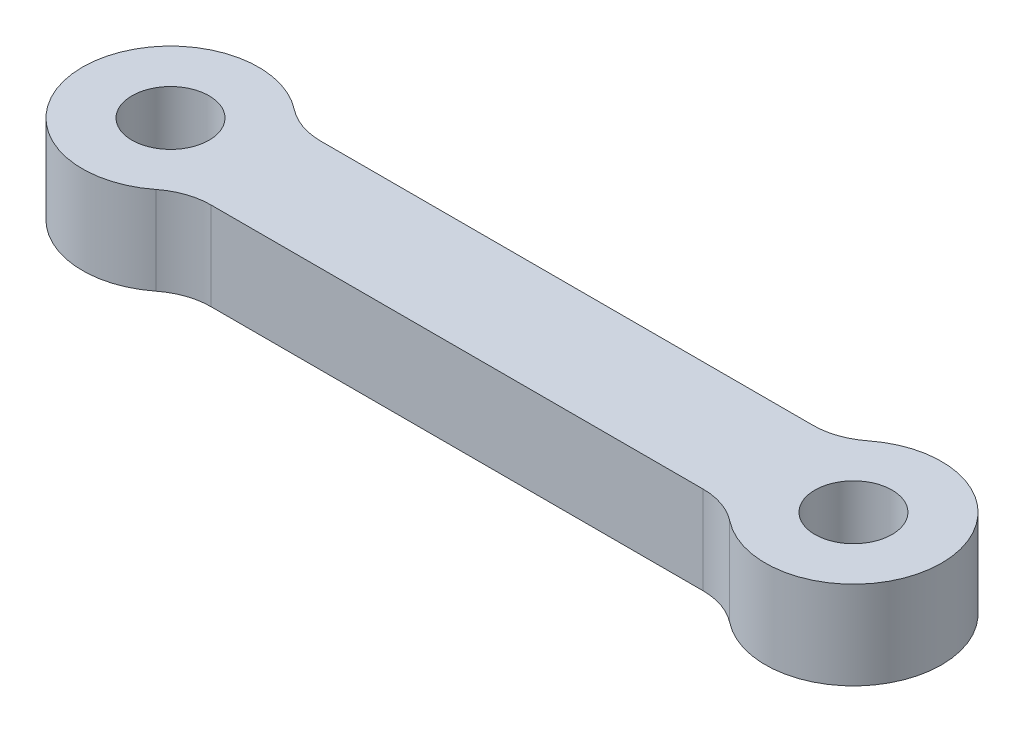
from build123d import *

# Parameters (mm, degrees)
SKETCH1_R           = 4
SKETCH1_R_2         = 1.75
BOSS_EXTRUDE1_DEPTH = 4
FILLET1_R           = 3


with BuildPart() as part:
    # Sketch1 → Boss-Extrude1 (new body)
    # profile 1 of 4: a face of its own
    with BuildSketch(Plane(origin=(0, 0, 0), x_dir=(1, 0, 0), z_dir=(0, 1, 0))):
        Circle(SKETCH1_R)
        with Locations(Location((0, 0, 0), (0, 0, 270))):
            Circle(SKETCH1_R_2, mode=Mode.SUBTRACT)
    # profile 2 of 4: a face of its own
    with BuildSketch(Plane(origin=(0, 0, 0), x_dir=(1, 0, 0), z_dir=(0, 1, 0))):
        with BuildLine():
            Line((27.877501001, 2.5), (3.122498999, 2.5))
            ThreePointArc((3.122498999, 2.5), (3.774254628, 1.324764885), (4, 0))
            Line((4, 0), (27, 0))
            ThreePointArc((27, 0), (27.225745372, 1.324764885), (27.877501001, 2.5))
        make_face()
    # profile 3 of 4: a face of its own
    with BuildSketch(Plane(origin=(0, 0, 0), x_dir=(1, 0, 0), z_dir=(0, 1, 0))):
        with BuildLine():
            Line((27, 0), (4, 0))
            ThreePointArc((4, 0), (3.774254628, -1.324764885), (3.122498999, -2.5))
            Line((3.122498999, -2.5), (27.877501001, -2.5))
            ThreePointArc((27.877501001, -2.5), (27.225745372, -1.324764885), (27, 0))
        make_face()
    # profile 4 of 4: a face of its own
    with BuildSketch(Plane(origin=(0, 0, 0), x_dir=(1, 0, 0), z_dir=(0, 1, 0))):
        with Locations((31, 0)):
            Circle(SKETCH1_R)
        with Locations(Location((31, 0, 0), (0, 0, 270))):
            Circle(SKETCH1_R_2, mode=Mode.SUBTRACT)
    extrude(amount=BOSS_EXTRUDE1_DEPTH)

    # Fillet1
    fillet1_edges = [part.edges().sort_by_distance(p)[0] for p in [
        (27.877501001, 2, 2.5),
        (3.122498999, 2, 2.5),
        (3.122498999, 2, -2.5),
        (27.877501001, 2, -2.5),
    ]]
    fillet(fillet1_edges, radius=FILLET1_R)


solid = part.part
